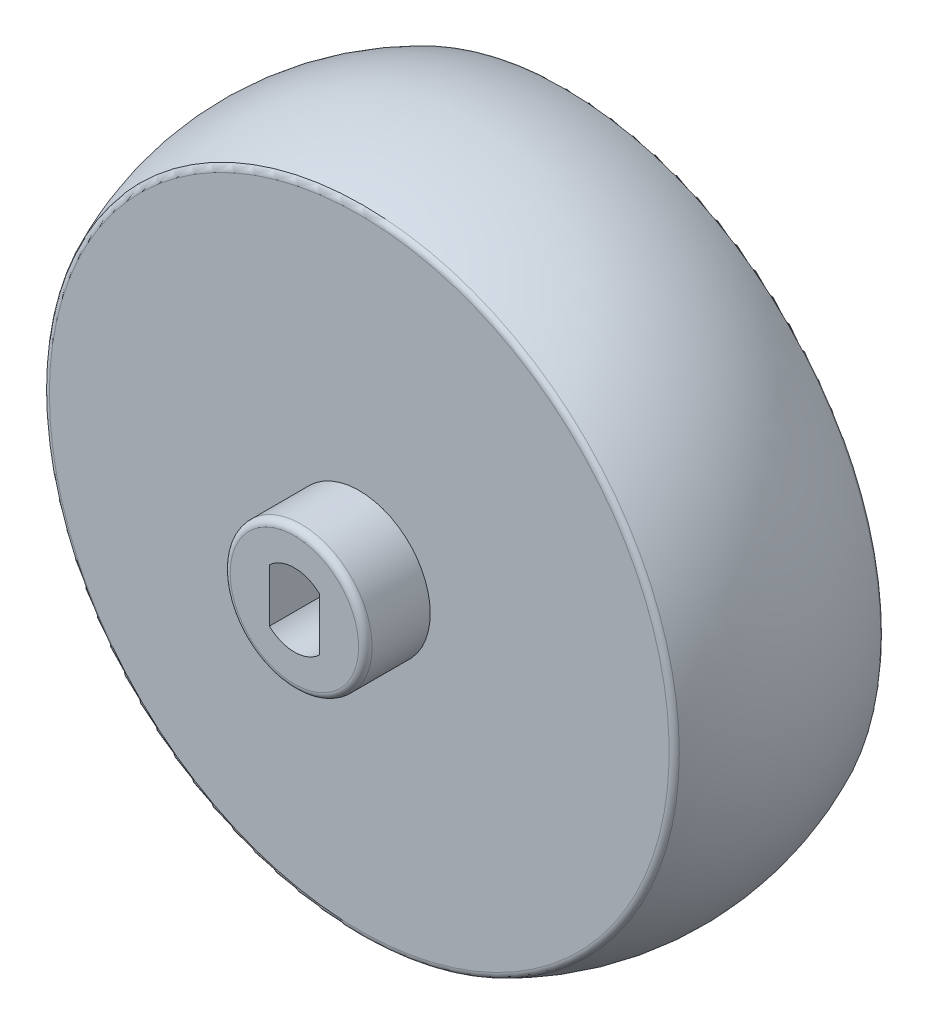
from build123d import *

# Parameters (mm, degrees)
CUT_EXTRUDE1_DEPTH = 11.7
FILLET1_R          = 0.5


with BuildPart() as part:
    # Sketch1 → Revolve1 (revolve)
    with BuildSketch(Plane(origin=(0, 0, 0), x_dir=(0, 0, -1), z_dir=(1, 0, 0)), mode=Mode.PRIVATE) as revolve1_sk:
        with BuildLine():
            Line((-12.55, 0), (-12.55, 5.25))
            Line((-12.55, 5.25), (-7.75, 5.25))
            Line((-7.75, 5.25), (-7.75, 23.25))
            ThreePointArc((-7.75, 23.25), (0, 25), (7.75, 23.25))
            Line((7.75, 23.25), (7.75, 5.25))
            Line((7.75, 5.25), (12.55, 5.25))
            Line((12.55, 5.25), (12.55, 0))
            Line((12.55, 0), (-12.55, 0))
        make_face()
    revolve(revolve1_sk.sketch.rotate(Axis((0, 0, 18.636822546), (0, 0, -1)), 90), axis=Axis((0, 0, 18.636822546), (0, 0, -1)))

    # Sketch2 → Cut-Revolve1 (revolve, cut)
    with BuildSketch(Plane(origin=(0, 0, 0), x_dir=(0, 0, -1), z_dir=(1, 0, 0)), mode=Mode.PRIVATE) as cut_revolve1_sk:
        Polygon((12.55, 0), (12.55, 2.75), (7.75, 2.75), (7.75, 1.5), (-0.85, 1.5), (-0.85, 0), align=None)
    revolve(cut_revolve1_sk.sketch.rotate(Axis((0, 0, 16.393312062), (0, 0, -1)), 90), axis=Axis((0, 0, 16.393312062), (0, 0, -1)), mode=Mode.SUBTRACT)

    # Sketch3 → Cut-Extrude1 (cut)
    with BuildSketch(Plane.XY.offset(12.55)):
        with BuildLine():
            Line((-1.85, -1.966596044), (-1.85, 1.966596044))
            ThreePointArc((-1.85, 1.966596044), (0, 2.7), (1.85, 1.966596044))
            Line((1.85, 1.966596044), (1.85, -1.966596044))
            ThreePointArc((1.85, -1.966596044), (0, -2.7), (-1.85, -1.966596044))
        make_face()
    extrude(amount=-CUT_EXTRUDE1_DEPTH, mode=Mode.SUBTRACT)

    # Fillet1
    fillet1_edges = [part.edges().sort_by_distance(p)[0] for p in [
        (-5.25, 0, 12.55),
        (-23.25, 0, 7.75),
        (-23.25, 0, -7.75),
        (-5.25, 0, -12.55),
    ]]
    fillet(fillet1_edges, radius=FILLET1_R)


solid = part.part
